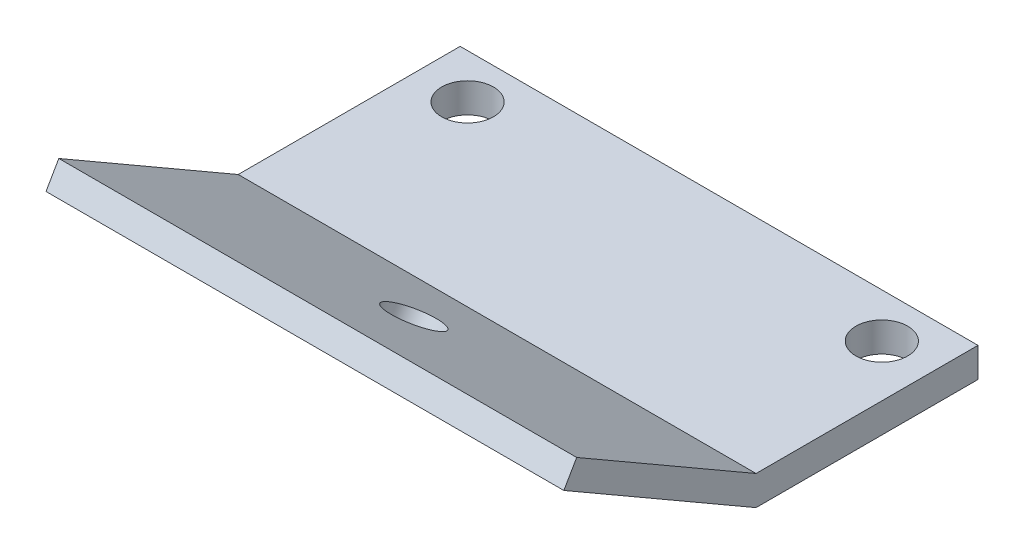
from build123d import *

# Parameters (mm, degrees)
CROQUIS1_W              = 35
CROQUIS1_H              = 15
SALIENTE_EXTRUIR1_DEPTH = 2
CROQUIS2_R              = 1.75
CORTAR_EXTRUIR1_DEPTH   = 20.144189719
CROQUIS3_W              = 35
CROQUIS3_H              = 1.732050808
SALIENTE_EXTRUIR2_DEPTH = 15
CORTAR_EXTRUIR2_REACH   = 30.333
CROQUIS4_R              = 1.75


with BuildPart() as part:
    # Croquis1 → Saliente-Extruir1 (new body)
    with BuildSketch(Plane(origin=(0, 0, 0), x_dir=(1, 0, 0), z_dir=(0, 1, 0))):
        Rectangle(CROQUIS1_W, CROQUIS1_H)
    extrude(amount=SALIENTE_EXTRUIR1_DEPTH)

    # Croquis2 → Cortar-Extruir1 (cut, through all)
    with BuildSketch(Plane(origin=(0, 2, 0), x_dir=(1, 0, 0), z_dir=(0, 1, 0))):
        with Locations(Location((-14, 4.5, 0), (0, 0, 270))):
            Circle(CROQUIS2_R)
        with Locations(Location((14, 4.5, 0), (0, 0, 270))):
            Circle(CROQUIS2_R)
    extrude(amount=-CORTAR_EXTRUIR1_DEPTH, mode=Mode.SUBTRACT)

    # Croquis3 → Saliente-Extruir2 (add)
    with BuildSketch(Plane(origin=(0, 3.247595264, 5.625), x_dir=(1, 0, 0), z_dir=(0, 0.500000000000001, 0.866025403784438))):
        with Locations((0, -2.883974596)):
            Rectangle(CROQUIS3_W, CROQUIS3_H)
    extrude(amount=SALIENTE_EXTRUIR2_DEPTH)

    # Croquis4 → Cortar-Extruir2 (cut, up to next)
    with BuildSketch(Plane(origin=(0, -3.247595264, 1.875), x_dir=(1, 0, 0), z_dir=(0, -0.8660254037844382, 0.5000000000000011)), mode=Mode.PRIVATE) as cortar_extruir2_sk1:
        with Locations(Location((0, 13.995190528, 0), (0, 0, 270))):
            Circle(CROQUIS4_R)
    cortar_extruir2_tool1 = extrude(cortar_extruir2_sk1.sketch, amount=-CORTAR_EXTRUIR2_REACH, mode=Mode.PRIVATE) & part.part
    add(cortar_extruir2_tool1.solids().sort_by_distance((0, 3.75, 13.995191))[0], mode=Mode.SUBTRACT)


solid = part.part
